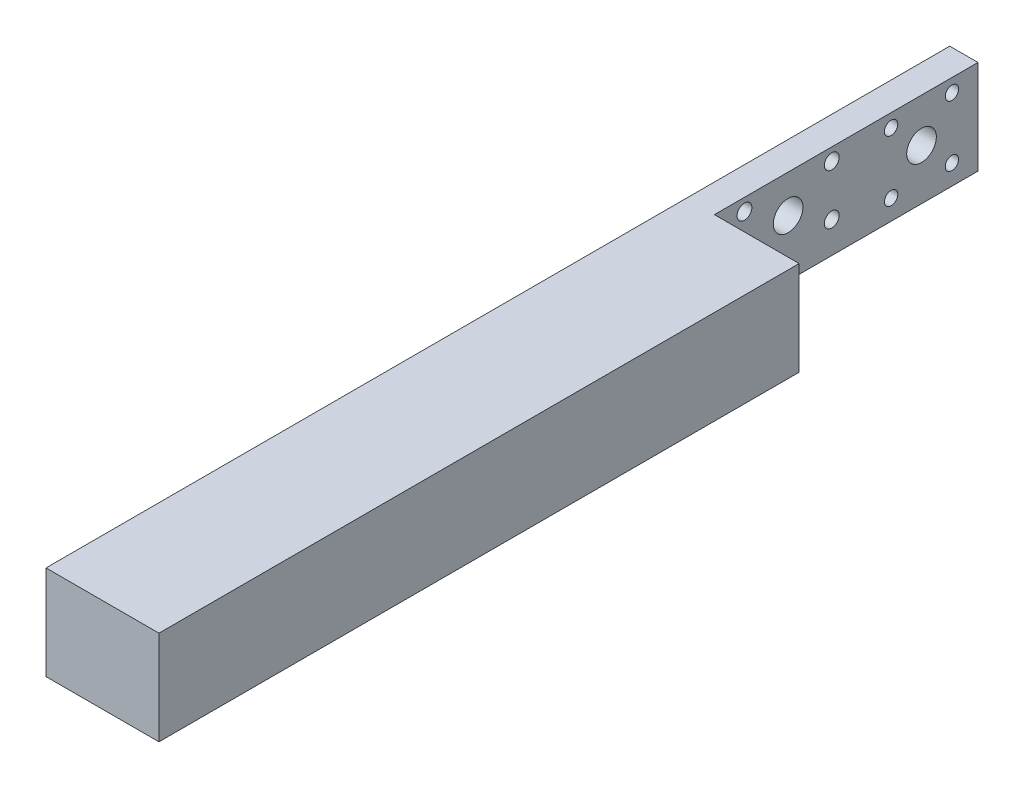
from build123d import *

# Parameters (mm, degrees)
SKETCH1_W           = 38.1
SKETCH1_H           = 38.1
BOSS_EXTRUDE1_DEPTH = 304.8
SKETCH2_R           = 5
CUT_EXTRUDE1_DEPTH  = 308.762168728
SKETCH4_R           = 2.5
CUT_EXTRUDE3_DEPTH  = 308.762168728
CIRPATTERN2_COUNT   = 6
SKETCH5_R           = 2.25
CUT_EXTRUDE4_DEPTH  = 308.762168728
CIRPATTERN3_COUNT   = 4
SKETCH6_W           = 88.9
SKETCH6_H           = 38.1
CUT_EXTRUDE5_DEPTH  = 28.575
SKETCH7_W           = 38.1
SKETCH7_H           = 6.35
CUT_EXTRUDE6_DEPTH  = 306.9883086


with BuildPart() as part:
    # Sketch1 → Boss-Extrude1 (new body)
    with BuildSketch(Plane.XY):
        Rectangle(SKETCH1_W, SKETCH1_H)
    extrude(amount=BOSS_EXTRUDE1_DEPTH)

    # Sketch2 → Cut-Extrude1 (cut, through all)
    with BuildSketch(Plane(origin=(19.05, 0, 0), x_dir=(0, 0, -1), z_dir=(1, 0, 0))):
        with Locations(Location((-19.05, -2, 0), (0, 0, 90))):
            Circle(SKETCH2_R)
        with Locations(Location((-64.05, 0, 0), (0, 0, 90))):
            Circle(SKETCH2_R)
    extrude(amount=-CUT_EXTRUDE1_DEPTH, mode=Mode.SUBTRACT)

    # Sketch4 → Cut-Extrude3 (cut, through all)
    with BuildSketch(Plane(origin=(19.05, 0, 0), x_dir=(0, 0, -1), z_dir=(1, 0, 0))):
        with Locations(Location((-78.768873451, 8.497872059, 0), (0, 0, 90))):
            Circle(SKETCH4_R)
    cut_extrude3 = extrude(amount=-CUT_EXTRUDE3_DEPTH, mode=Mode.SUBTRACT)

    # CirPattern2: Cut-Extrude3 ×6 about axis, 2 skipped
    cirpattern2_axis = Axis((0, 0, 64.05), (1, 0, 0))
    add([cut_extrude3.rotate(cirpattern2_axis, i * 360 / CIRPATTERN2_COUNT) for i in range(1, CIRPATTERN2_COUNT) if i not in (2, 5)], mode=Mode.SUBTRACT)

    # Sketch5 → Cut-Extrude4 (cut, through all)
    with BuildSketch(Plane(origin=(19.05, 0, 0), x_dir=(0, 0, -1), z_dir=(1, 0, 0))):
        with Locations(Location((-29.303048327, 8.253048327, 0), (0, 0, 90))):
            Circle(SKETCH5_R)
    cut_extrude4 = extrude(amount=-CUT_EXTRUDE4_DEPTH, mode=Mode.SUBTRACT)

    # CirPattern3: Cut-Extrude4 ×4 about axis
    cirpattern3_axis = Axis((0, -2, 19.05), (1, 0, 0))
    for i in range(1, CIRPATTERN3_COUNT):
        add(cut_extrude4.rotate(cirpattern3_axis, i * 360 / CIRPATTERN3_COUNT), mode=Mode.SUBTRACT)

    # Sketch6 → Cut-Extrude5 (cut)
    with BuildSketch(Plane(origin=(19.05, 0, 0), x_dir=(0, 0, -1), z_dir=(1, 0, 0))):
        with Locations((-44.45, 0)):
            Rectangle(SKETCH6_W, SKETCH6_H)
    extrude(amount=-CUT_EXTRUDE5_DEPTH, mode=Mode.SUBTRACT)

    # Sketch7 → Cut-Extrude6 (cut, through all)
    with BuildSketch(Plane.XY.offset(304.8)):
        with Locations((0, 15.875)):
            Rectangle(SKETCH7_W, SKETCH7_H)
    extrude(amount=-CUT_EXTRUDE6_DEPTH, mode=Mode.SUBTRACT)


solid = part.part
